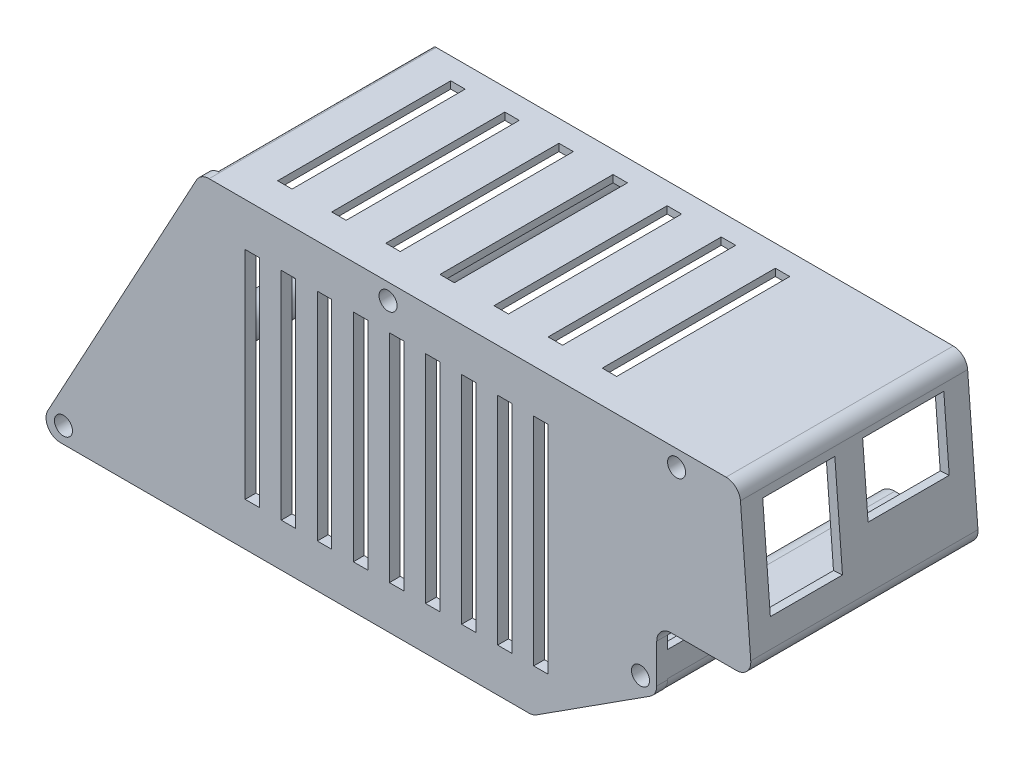
from build123d import *
from build123d.topology import SkipClean

# Parameters (mm, degrees)
SKETCH3_R           = 2.5
BOSS_EXTRUDE5_DEPTH = 3
BOSS_EXTRUDE6_START = 60
SKETCH12_R          = 2.5
BOSS_EXTRUDE6_DEPTH = 60
CUT_EXTRUDE4_REACH  = 218.071
SKETCH13_W          = 22.5
SKETCH13_H          = 19.5
SKETCH13_W_2        = 20
SKETCH13_H_2        = 27.5
CUT_EXTRUDE5_REACH  = 198.459
EARTH_WIRE_W        = 9
EARTH_WIRE_H        = 3.5
CUT_EXTRUDE6_REACH  = 217.89
SKETCH15_W          = 4
SKETCH15_H          = 60
LPATTERN1_COUNT     = 9
LPATTERN1_PITCH     = 10
SKETCH17_W          = 4
SKETCH17_H          = 48
CUT_EXTRUDE8_DEPTH  = 60


with BuildPart() as part:
    # Sketch3 → Boss-Extrude5 (new body)
    with BuildSketch(Plane.XY):
        with BuildLine():
            Line((183.717325824, 79.5), (40.380952381, 79.5))
            ThreePointArc((40.380952381, 79.5), (38.335016942, 78.937171538), (36.864836851, 77.40707409))
            Line((36.864836851, 77.40707409), (-4.35611553, 1.40707409))
            ThreePointArc((-4.35611553, 1.40707409), (-4.277171538, -2.545935439), (-0.84, -4.5))
            Line((-0.84, -4.5), (129.013538649, -4.5))
            ThreePointArc((129.013538649, -4.5), (130.140115123, -4.338075748), (131.175481572, -3.865412723))
            Line((131.175481572, -3.865412723), (162.661942923, 16.361506792))
            ThreePointArc((162.661942923, 16.361506792), (164.010539253, 17.809599992), (164.5, 19.726919515))
            Line((164.5, 19.726919515), (164.5, 30.5))
            ThreePointArc((164.5, 30.5), (165.671572875, 33.328427125), (168.5, 34.5))
            Line((168.5, 34.5), (186.576416733, 34.5))
            ThreePointArc((186.576416733, 34.5), (189.511777773, 35.782711726), (190.5645278, 38.808172219))
            Line((190.5645278, 38.808172219), (187.705436891, 75.808172219))
            ThreePointArc((187.705436891, 75.808172219), (186.434614098, 78.43536104), (183.717325824, 79.5))
        make_face()
        Circle(SKETCH3_R, mode=Mode.SUBTRACT)
        with Locations((90, 75)):
            Circle(SKETCH3_R, mode=Mode.SUBTRACT)
        with Locations((170, 75)):
            Circle(SKETCH3_R, mode=Mode.SUBTRACT)
        with Locations((160, 20)):
            Circle(SKETCH3_R, mode=Mode.SUBTRACT)
    extrude(amount=BOSS_EXTRUDE5_DEPTH)

    # Sketch12 → Boss-Extrude6 (add)
    # profile 1 of 2: a face of its own
    with SkipClean():  # the faces are left unmerged after this step: merging them gives an invalid solid
        with BuildSketch(Plane(origin=(0, 0, 0), x_dir=(-1, 0, 0), z_dir=(0, 0, -1)).offset(BOSS_EXTRUDE6_START)):
            with BuildLine():
                Line((-86.258342613, 77.5), (-40.380952381, 77.5))
                ThreePointArc((-40.380952381, 77.5), (-39.380952381, 78.5), (-40.380952381, 79.5))
                Line((-40.380952381, 79.5), (-183.717325824, 79.5))
                ThreePointArc((-183.717325824, 79.5), (-186.434614098, 78.43536104), (-187.705436891, 75.808172219))
                Line((-187.705436891, 75.808172219), (-190.5645278, 38.808172219))
                ThreePointArc((-190.5645278, 38.808172219), (-189.511777773, 35.782711726), (-186.576416733, 34.5))
                Line((-186.576416733, 34.5), (-168.5, 34.5))
                ThreePointArc((-168.5, 34.5), (-165.671572875, 33.328427125), (-164.5, 30.5))
                Line((-164.5, 30.5), (-164.5, 20))
                ThreePointArc((-164.5, 20), (-163.949356659, 17.843015536), (-162.432185788, 16.213910686))
                Line((-162.432185788, 16.213910686), (-141.605507863, 2.834841713))
                ThreePointArc((-141.605507863, 2.834841713), (-140.223668952, 3.135709163), (-140.524536402, 4.517548074))
                Line((-140.524536402, 4.517548074), (-158.203158983, 15.874304621))
                ThreePointArc((-158.203158983, 15.874304621), (-156.050643341, 22.156984464), (-162.5, 23.741657387))
                Line((-162.5, 23.741657387), (-162.5, 31.5))
                ThreePointArc((-162.5, 31.5), (-163.964466094, 35.035533906), (-167.5, 36.5))
                Line((-167.5, 36.5), (-184.994672365, 36.5))
                ThreePointArc((-184.994672365, 36.5), (-187.196193145, 37.462033795), (-187.985755665, 39.731129164))
                Line((-187.985755665, 39.731129164), (-185.281210211, 74.731129164))
                ThreePointArc((-185.281210211, 74.731129164), (-184.328093116, 76.70152078), (-182.290126911, 77.5))
                Line((-182.290126911, 77.5), (-173.741657387, 77.5))
                ThreePointArc((-173.741657387, 77.5), (-170, 70.5), (-166.258342613, 77.5))
                Line((-166.258342613, 77.5), (-93.741657387, 77.5))
                ThreePointArc((-93.741657387, 77.5), (-90, 70.5), (-86.258342613, 77.5))
            make_face()
            with Locations((-90, 75)):
                Circle(SKETCH12_R, mode=Mode.SUBTRACT)
            with Locations((-170, 75)):
                Circle(SKETCH12_R, mode=Mode.SUBTRACT)
            with Locations((-160, 20)):
                Circle(SKETCH12_R, mode=Mode.SUBTRACT)
        # profile 2 of 2: a face of its own
        with BuildSketch(Plane(origin=(0, 0, 0), x_dir=(-1, 0, 0), z_dir=(0, 0, -1)).offset(BOSS_EXTRUDE6_START)):
            with BuildLine():
                Line((4.35611553, 1.40707409), (3.955629971, 2.145458351))
                ThreePointArc((3.955629971, 2.145458351), (-3.86681798, 2.301677369), (0, -4.5))
                Line((0, -4.5), (0.84, -4.5))
                ThreePointArc((0.84, -4.5), (4.277171538, -2.545935439), (4.35611553, 1.40707409))
            make_face()
            Circle(SKETCH12_R, mode=Mode.SUBTRACT)
        extrude(amount=-BOSS_EXTRUDE6_DEPTH)

    # Sketch13 → Cut-Extrude4 (cut, up to next)
    with BuildSketch(Plane(origin=(192.414420292, 14.868387023, 0), x_dir=(0, 0, -1), z_dir=(0.9970277667756612, 0.07704305470539174, 0)), mode=Mode.PRIVATE) as cut_extrude4_sk1:
        with Locations((42, 49.621452408)):
            Rectangle(SKETCH13_W, SKETCH13_H)
    cut_extrude4_tool1 = extrude(cut_extrude4_sk1.sketch, amount=-CUT_EXTRUDE4_REACH, mode=Mode.PRIVATE) & part.part
    # Sketch13 → Cut-Extrude4 (cut, up to next)
    with BuildSketch(Plane(origin=(192.414420292, 14.868387023, 0), x_dir=(0, 0, -1), z_dir=(0.9970277667756612, 0.07704305470539174, 0)), mode=Mode.PRIVATE) as cut_extrude4_sk2:
        with Locations((13, 45.121452408)):
            Rectangle(SKETCH13_W_2, SKETCH13_H_2)
    cut_extrude4_tool2 = extrude(cut_extrude4_sk2.sketch, amount=-CUT_EXTRUDE4_REACH, mode=Mode.PRIVATE) & part.part
    add(cut_extrude4_tool1.solids().sort_by_distance((188.591432, 64.342353, -42))[0], mode=Mode.SUBTRACT)
    add(cut_extrude4_tool2.solids().sort_by_distance((188.938126, 59.855728, -13))[0], mode=Mode.SUBTRACT)

    # Earth wire → Cut-Extrude5 (cut, up to next)
    with BuildSketch(Plane(origin=(164.5, 0, 0), x_dir=(0, 0, -1), z_dir=(1, 0, 0)), mode=Mode.PRIVATE) as cut_extrude5_sk1:
        with Locations((4.5, 28.75)):
            Rectangle(EARTH_WIRE_W, EARTH_WIRE_H)
    cut_extrude5_tool1 = extrude(cut_extrude5_sk1.sketch, amount=-CUT_EXTRUDE5_REACH, mode=Mode.PRIVATE) & part.part
    add(cut_extrude5_tool1.solids().sort_by_distance((164.5, 28.75, -4.5))[0], mode=Mode.SUBTRACT)

    # Sketch15 → Cut-Extrude6 (cut, up to next)
    with BuildSketch(Plane.XY.offset(3), mode=Mode.PRIVATE) as cut_extrude6_sk1:
        with Locations((52.380952381, 37.5)):
            Rectangle(SKETCH15_W, SKETCH15_H)
    cut_extrude6_tool1 = extrude(cut_extrude6_sk1.sketch, amount=-CUT_EXTRUDE6_REACH, mode=Mode.PRIVATE) & part.part
    cut_extrude6 = cut_extrude6_tool1.solids().sort_by_distance((52.380952, 37.5, 3))[0]
    add(cut_extrude6, mode=Mode.SUBTRACT)

    # LPattern1: Cut-Extrude6 ×9
    with SkipClean():  # the faces are left unmerged after this step: merging them gives an invalid solid
        with Locations(*[(i * LPATTERN1_PITCH, 0, 0) for i in range(1, LPATTERN1_COUNT)]):
            add(cut_extrude6, mode=Mode.SUBTRACT)

    # Sketch17 → Cut-Extrude8 (cut)
    with SkipClean():  # the faces are left unmerged after this step: merging them gives an invalid solid
        with BuildSketch(Plane(origin=(0, 79.5, 0), x_dir=(1, 0, 0), z_dir=(0, 1, 0))):
            with Locations((52.380952381, 30)):
                Rectangle(SKETCH17_W, SKETCH17_H)
            with Locations((67.380952381, 30)):
                Rectangle(SKETCH17_W, SKETCH17_H)
            with Locations((82.380952381, 30)):
                Rectangle(SKETCH17_W, SKETCH17_H)
            with Locations((97.380952381, 30)):
                Rectangle(SKETCH17_W, SKETCH17_H)
            with Locations((112.380952381, 30)):
                Rectangle(SKETCH17_W, SKETCH17_H)
            with Locations((127.380952381, 30)):
                Rectangle(SKETCH17_W, SKETCH17_H)
            with Locations((142.380952381, 30)):
                Rectangle(SKETCH17_W, SKETCH17_H)
        extrude(amount=-CUT_EXTRUDE8_DEPTH, mode=Mode.SUBTRACT)


solid = part.part
